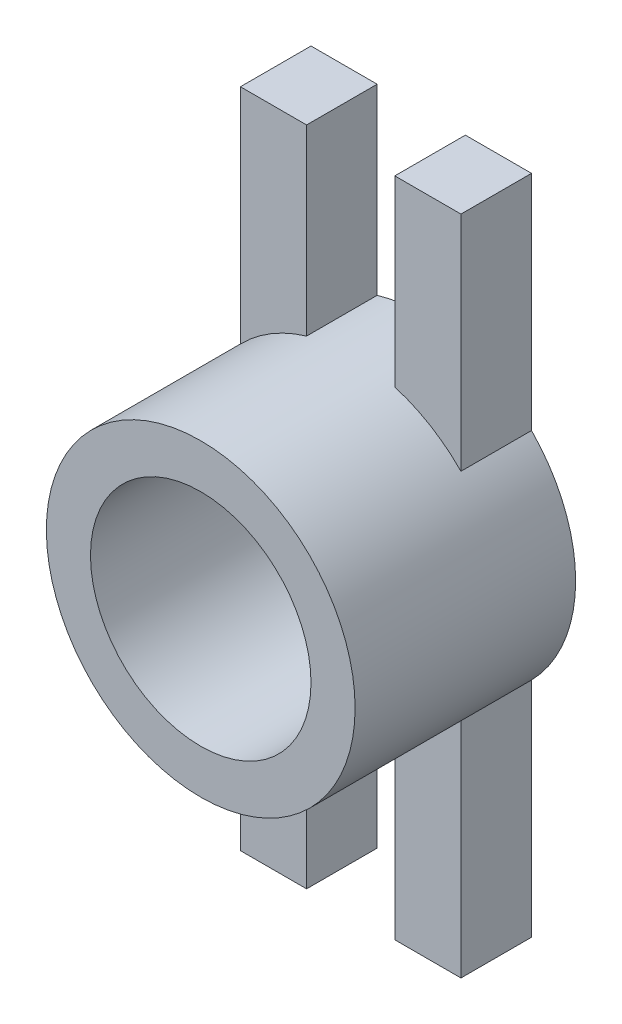
from build123d import *

# Parameters (mm, degrees)
SKETCH1_R           = 25
BOSS_EXTRUDE1_DEPTH = 50
BOSS_EXTRUDE2_DEPTH = 16


with BuildPart() as part:
    # Sketch1 → Boss-Extrude1 (new body)
    with BuildSketch(Plane(origin=(0, 0, 0), x_dir=(0, 1, 0), z_dir=(0, 0, 1))):
        with BuildLine():
            ThreePointArc((-33.541019662, 10), (-35, 0), (-33.541019662, -10))
            ThreePointArc((-33.541019662, -10), (-29.971518449, -18.075067963), (-24.494897428, -25))
            ThreePointArc((-24.494897428, -25), (0, -35), (24.494897428, -25))
            ThreePointArc((24.494897428, -25), (29.971518449, -18.075067963), (33.541019662, -10))
            ThreePointArc((33.541019662, -10), (34.633334291, -5.052935375), (35, 0))
            ThreePointArc((35, 0), (34.633334291, 5.052935375), (33.541019662, 10))
            ThreePointArc((33.541019662, 10), (29.971518449, 18.075067963), (24.494897428, 25))
            ThreePointArc((24.494897428, 25), (0, 35), (-24.494897428, 25))
            ThreePointArc((-24.494897428, 25), (-29.971518449, 18.075067963), (-33.541019662, 10))
        make_face()
        Circle(SKETCH1_R, mode=Mode.SUBTRACT)
    extrude(amount=BOSS_EXTRUDE1_DEPTH)

    # Sketch1<3> → Boss-Extrude2 (add)
    with BuildSketch(Plane(origin=(0, 0, 0), x_dir=(0, 1, 0), z_dir=(0, 0, 1))):
        with BuildLine():
            Line((-33.541019662, -10), (-75, -10))
            Line((-75, -10), (-75, -25))
            Line((-75, -25), (-24.494897428, -25))
            ThreePointArc((-24.494897428, -25), (-29.971518449, -18.075067963), (-33.541019662, -10))
        make_face()
        with BuildLine():
            Line((-75, 10), (-33.541019662, 10))
            ThreePointArc((-33.541019662, 10), (-29.971518449, 18.075067963), (-24.494897428, 25))
            Line((-24.494897428, 25), (-75, 25))
            Line((-75, 25), (-75, 10))
        make_face()
        with BuildLine():
            ThreePointArc((33.541019662, -10), (29.971518449, -18.075067963), (24.494897428, -25))
            Line((24.494897428, -25), (75, -25))
            Line((75, -25), (75, -10))
            Line((75, -10), (33.541019662, -10))
        make_face()
        with BuildLine():
            Line((75, 25), (24.494897428, 25))
            ThreePointArc((24.494897428, 25), (29.971518449, 18.075067963), (33.541019662, 10))
            Line((33.541019662, 10), (75, 10))
            Line((75, 10), (75, 25))
        make_face()
    extrude(amount=BOSS_EXTRUDE2_DEPTH)


solid = part.part
